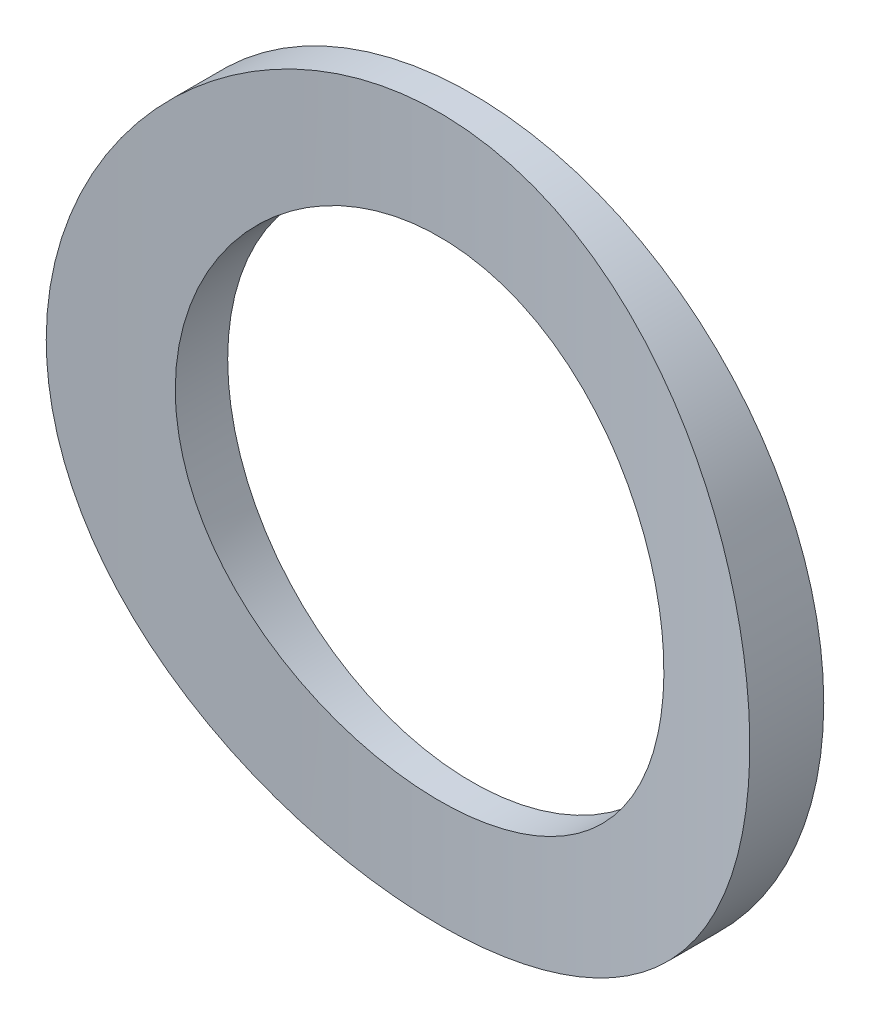
from build123d import *

# Parameters (mm, degrees)
SKETCH1_R               = 10.8
SKETCH1_R_2             = 7.5
BOSS_EXTRUDE1_DEPTH     = 30
CUT_EXTRUDE1_DEPTH      = 34.664224334
CUT_EXTRUDE1_DEPTH_BACK = 34.664224334
SKETCH2_R               = 46.53


with BuildPart() as part:
    # Sketch1 → Boss-Extrude1 (new body)
    with BuildSketch(Plane.XY):
        Circle(SKETCH1_R)
        Circle(SKETCH1_R_2, mode=Mode.SUBTRACT)
    extrude(amount=BOSS_EXTRUDE1_DEPTH)

    # Sketch2 → Cut-Extrude1 (cut, two sides: drawn at the far end of the back side and taken through both)
    with BuildSketch(Plane(origin=(0, 0, 0), x_dir=(1, 0, 0), z_dir=(0, 1, 0)).offset(-CUT_EXTRUDE1_DEPTH_BACK)):
        with Locations((0, -47.53)):
            Circle(SKETCH2_R)
    extrude(amount=CUT_EXTRUDE1_DEPTH + CUT_EXTRUDE1_DEPTH_BACK, mode=Mode.SUBTRACT)


solid = part.part
